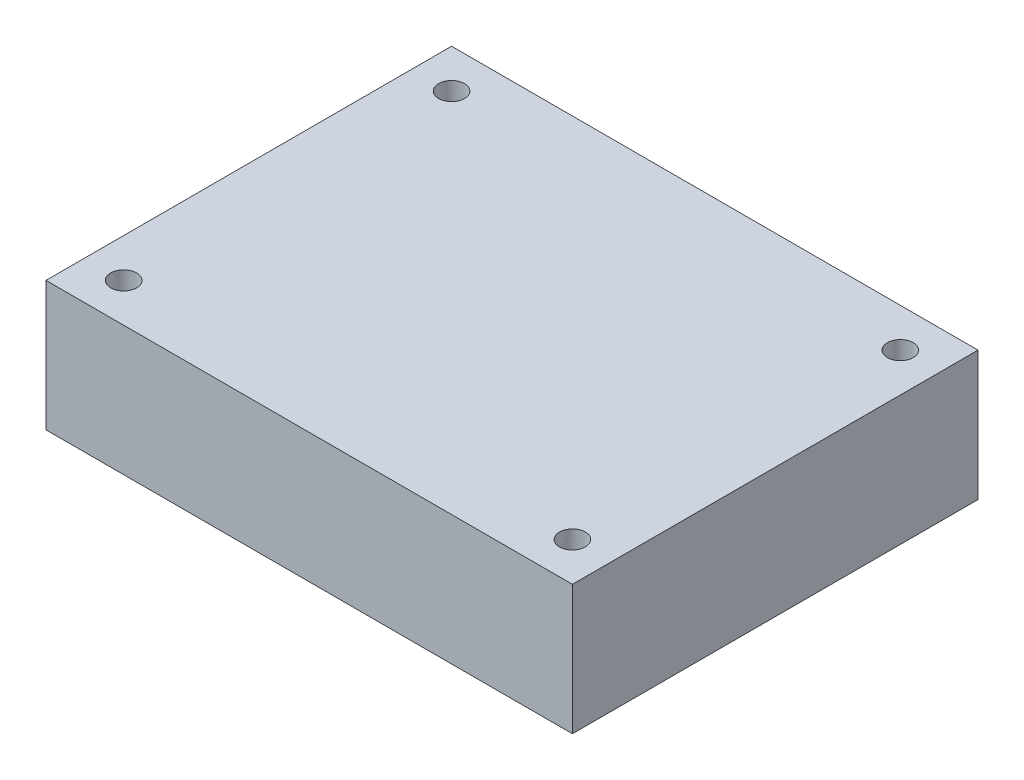
from build123d import *

# Parameters (mm, degrees)
SKETCH_1_W      = 61
SKETCH_1_H      = 47
SKETCH_1_R      = 1.5
SKETCH_1_R_2    = 1.501079812
EXTRUDE_2_DEPTH = 15


with BuildPart() as part:
    # 草图1 → 凸台-拉伸2 (new body)
    with BuildSketch(Plane(origin=(0, 0, 0), x_dir=(1, 0, 0), z_dir=(0, 1, 0))):
        with Locations((30.5, 23.5)):
            Rectangle(SKETCH_1_W, SKETCH_1_H)
        with Locations(Location((4.5, 42.5, 0), (0, 0, 270))):
            Circle(SKETCH_1_R, mode=Mode.SUBTRACT)
        with Locations(Location((56.5, 42.5, 0), (0, 0, 270))):
            Circle(SKETCH_1_R_2, mode=Mode.SUBTRACT)
        with Locations(Location((4.5, 4.5, 0), (0, 0, 270))):
            Circle(SKETCH_1_R, mode=Mode.SUBTRACT)
        with Locations(Location((56.5, 4.5, 0), (0, 0, 270))):
            Circle(SKETCH_1_R, mode=Mode.SUBTRACT)
    extrude(amount=EXTRUDE_2_DEPTH)


solid = part.part
